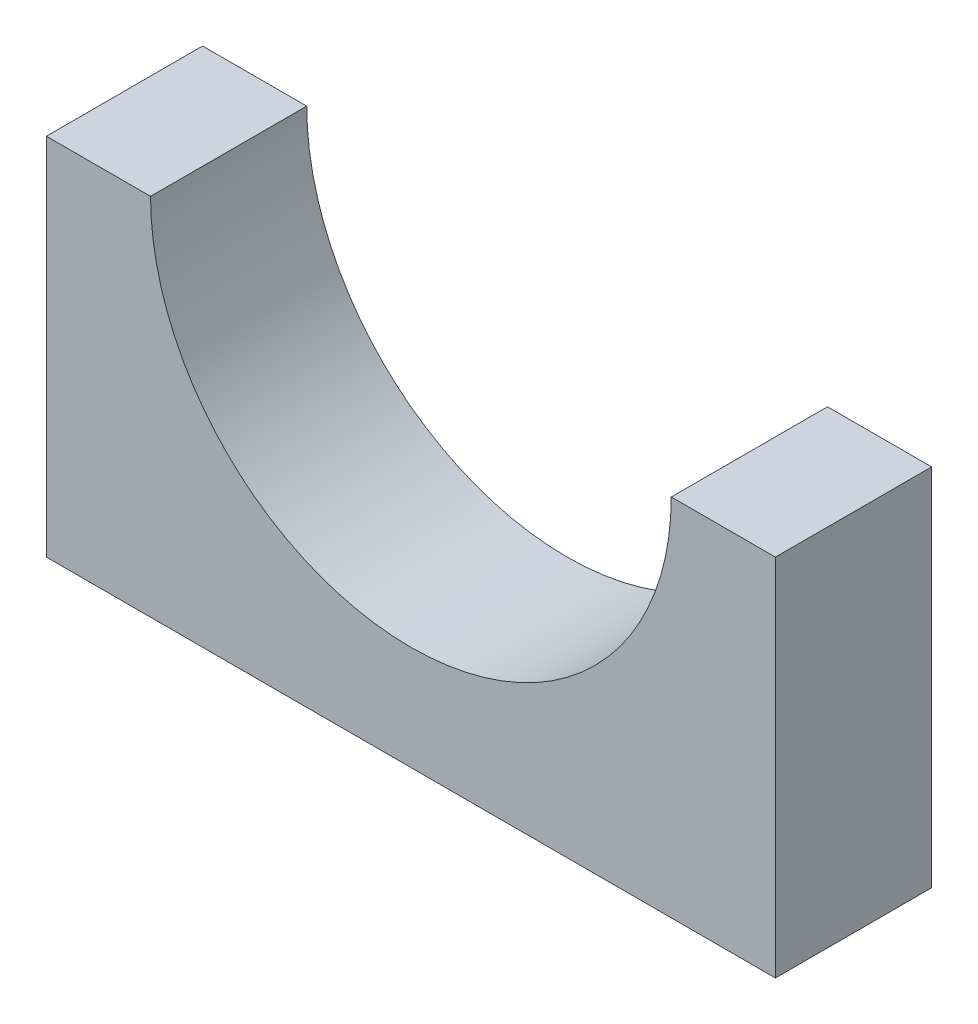
from build123d import *

# Parameters (mm, degrees)
BOSS_EXTRUDE1_DEPTH = 7.5


with BuildPart() as part:
    # Sketch1 → Boss-Extrude1 (new body)
    with BuildSketch(Plane.XY):
        with BuildLine():
            Line((-17.5, 0), (17.5, 0))
            Line((17.5, 0), (17.5, 17.5))
            Line((17.5, 17.5), (12.5, 17.5))
            ThreePointArc((12.5, 17.5), (0, 5), (-12.5, 17.5))
            Line((-12.5, 17.5), (-17.5, 17.5))
            Line((-17.5, 17.5), (-17.5, 0))
        make_face()
    extrude(amount=BOSS_EXTRUDE1_DEPTH)


solid = part.part
